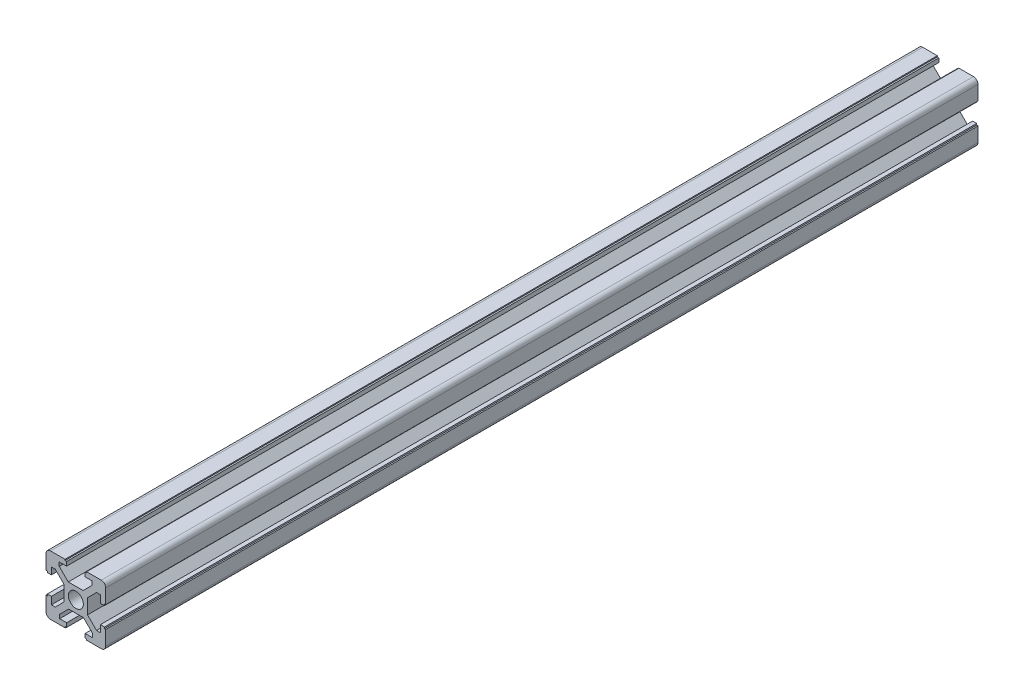
from build123d import *

# Parameters (mm, degrees)
SKETCH1_R           = 2.5
BOSS_EXTRUDE1_DEPTH = 292


with BuildPart() as part:
    # Sketch1 → Boss-Extrude1 (new body)
    with BuildSketch(Plane(origin=(0, 0, 0), x_dir=(-1, 0, 0), z_dir=(0, 0, -1))):
        with BuildLine():
            Line((-31.229112559, 24.389540696), (-31.229112559, 19.574084592))
            Line((-31.229112559, 19.574084592), (-30.801486653, 19.574084592))
            Line((-30.801486653, 19.574084592), (-30.801486653, 19.055371932))
            Line((-30.801486653, 19.055371932), (-29.429112559, 19.055371932))
            Line((-29.429112559, 19.055371932), (-29.429112559, 21.523527696))
            Line((-29.429112559, 21.523527696), (-28.141605593, 21.523527696))
            Line((-28.141605593, 21.523527696), (-25.129112559, 18.511034662))
            Line((-25.129112559, 18.511034662), (-25.129112559, 13.532983276))
            Line((-25.129112559, 13.532983276), (-28.141605593, 10.520490242))
            Line((-28.141605593, 10.520490242), (-29.429112559, 10.520490242))
            Line((-29.429112559, 10.520490242), (-29.429112559, 12.855371932))
            Line((-29.429112559, 12.855371932), (-30.801486653, 12.855371932))
            Line((-30.801486653, 12.855371932), (-30.801486653, 12.350696072))
            Line((-30.801486653, 12.350696072), (-31.229112559, 12.350696072))
            Line((-31.229112559, 12.350696072), (-31.229112559, 7.521203168))
            ThreePointArc((-31.229112559, 7.521203168), (-30.789772731, 6.460542996), (-29.729112559, 6.021203168))
            Line((-29.729112559, 6.021203168), (-24.847825219, 6.021203168))
            Line((-24.847825219, 6.021203168), (-24.847825219, 6.382997838))
            Line((-24.847825219, 6.382997838), (-24.329112559, 6.382997838))
            Line((-24.329112559, 6.382997838), (-24.329112559, 7.755371932))
            Line((-24.329112559, 7.755371932), (-26.797268323, 7.755371932))
            Line((-26.797268323, 7.755371932), (-26.797268323, 9.042878898))
            Line((-26.797268323, 9.042878898), (-23.784775289, 12.055371932))
            Line((-23.784775289, 12.055371932), (-18.806723903, 12.055371932))
            Line((-18.806723903, 12.055371932), (-15.794230869, 9.042878898))
            Line((-15.794230869, 9.042878898), (-15.794230869, 7.755371932))
            Line((-15.794230869, 7.755371932), (-18.129112559, 7.755371932))
            Line((-18.129112559, 7.755371932), (-18.129112559, 6.382997838))
            Line((-18.129112559, 6.382997838), (-17.624436699, 6.382997838))
            Line((-17.624436699, 6.382997838), (-17.624436699, 6.021203168))
            Line((-17.624436699, 6.021203168), (-12.729112559, 6.021203168))
            ThreePointArc((-12.729112559, 6.021203168), (-11.668452387, 6.460542996), (-11.229112559, 7.521203168))
            Line((-11.229112559, 7.521203168), (-11.229112559, 12.336659272))
            Line((-11.229112559, 12.336659272), (-11.656738465, 12.336659272))
            Line((-11.656738465, 12.336659272), (-11.656738465, 12.855371932))
            Line((-11.656738465, 12.855371932), (-13.029112559, 12.855371932))
            Line((-13.029112559, 12.855371932), (-13.029112559, 10.387216168))
            Line((-13.029112559, 10.387216168), (-14.316619525, 10.387216168))
            Line((-14.316619525, 10.387216168), (-17.329112559, 13.399709202))
            Line((-17.329112559, 13.399709202), (-17.329112559, 18.377760588))
            Line((-17.329112559, 18.377760588), (-14.316619525, 21.390253622))
            Line((-14.316619525, 21.390253622), (-13.029112559, 21.390253622))
            Line((-13.029112559, 21.390253622), (-13.029112559, 19.055371932))
            Line((-13.029112559, 19.055371932), (-11.656738465, 19.055371932))
            Line((-11.656738465, 19.055371932), (-11.656738465, 19.560047792))
            Line((-11.656738465, 19.560047792), (-11.229112559, 19.560047792))
            Line((-11.229112559, 19.560047792), (-11.229112559, 24.389540696))
            ThreePointArc((-11.229112559, 24.389540696), (-11.668452387, 25.450200868), (-12.729112559, 25.889540696))
            Line((-12.729112559, 25.889540696), (-17.610399899, 25.889540696))
            Line((-17.610399899, 25.889540696), (-17.610399899, 25.527746026))
            Line((-17.610399899, 25.527746026), (-18.129112559, 25.527746026))
            Line((-18.129112559, 25.527746026), (-18.129112559, 24.155371932))
            Line((-18.129112559, 24.155371932), (-15.660956795, 24.155371932))
            Line((-15.660956795, 24.155371932), (-15.660956795, 22.867864966))
            Line((-15.660956795, 22.867864966), (-18.673449829, 19.855371932))
            Line((-18.673449829, 19.855371932), (-23.651501215, 19.855371932))
            Line((-23.651501215, 19.855371932), (-26.663994249, 22.867864966))
            Line((-26.663994249, 22.867864966), (-26.663994249, 24.155371932))
            Line((-26.663994249, 24.155371932), (-24.329112559, 24.155371932))
            Line((-24.329112559, 24.155371932), (-24.329112559, 25.527746026))
            Line((-24.329112559, 25.527746026), (-24.833788419, 25.527746026))
            Line((-24.833788419, 25.527746026), (-24.833788419, 25.889540696))
            Line((-24.833788419, 25.889540696), (-29.729112559, 25.889540696))
            ThreePointArc((-29.729112559, 25.889540696), (-30.789772731, 25.450200868), (-31.229112559, 24.389540696))
        make_face()
        with Locations(Location((-21.229112559, 15.955371932, 0), (0, 0, 180))):
            Circle(SKETCH1_R, mode=Mode.SUBTRACT)
    extrude(amount=-BOSS_EXTRUDE1_DEPTH)


solid = part.part
